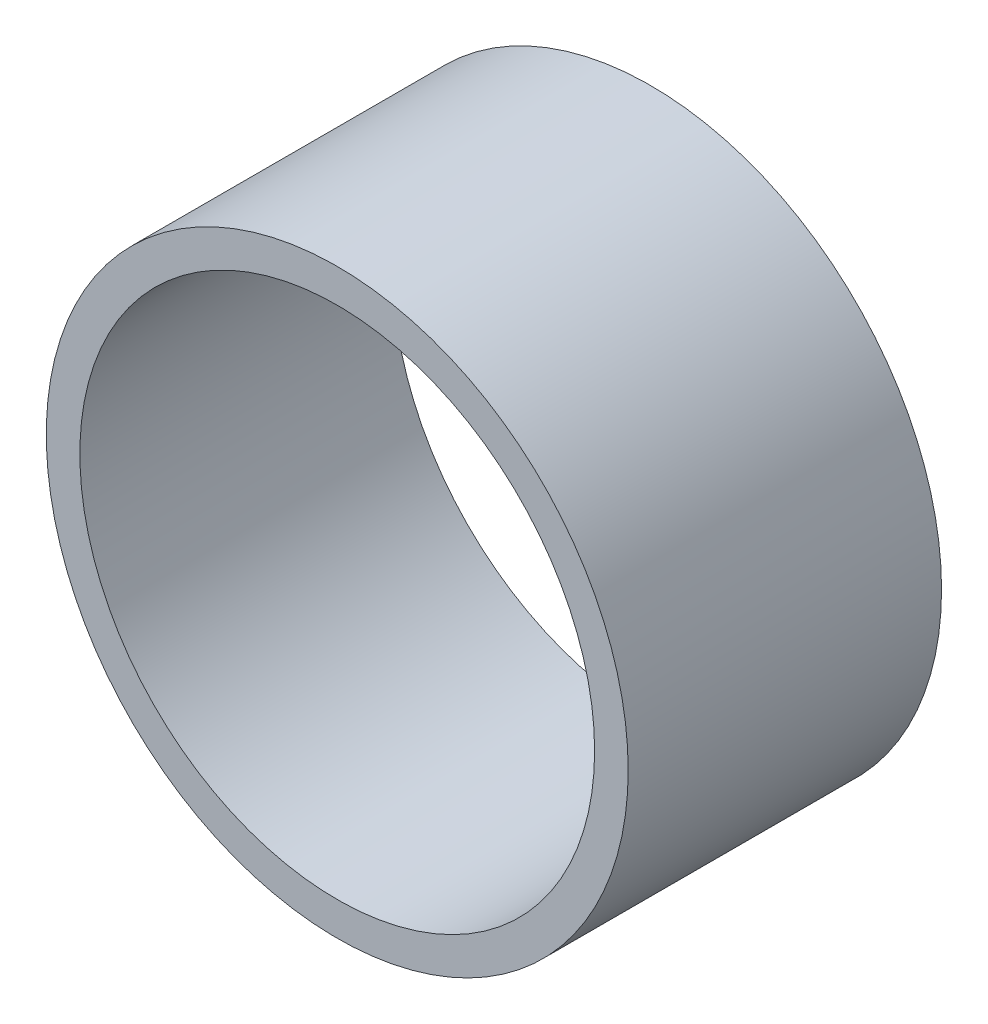
from build123d import *

# Parameters (mm, degrees)
ESQUISSE1_R        = 26
ESQUISSE1_R_2      = 23
BOSS_EXTRU_1_DEPTH = 28


with BuildPart() as part:
    # Esquisse1 → Boss.-Extru.1 (new body)
    with BuildSketch(Plane.XY):
        Circle(ESQUISSE1_R)
        Circle(ESQUISSE1_R_2, mode=Mode.SUBTRACT)
    extrude(amount=BOSS_EXTRU_1_DEPTH)


solid = part.part
